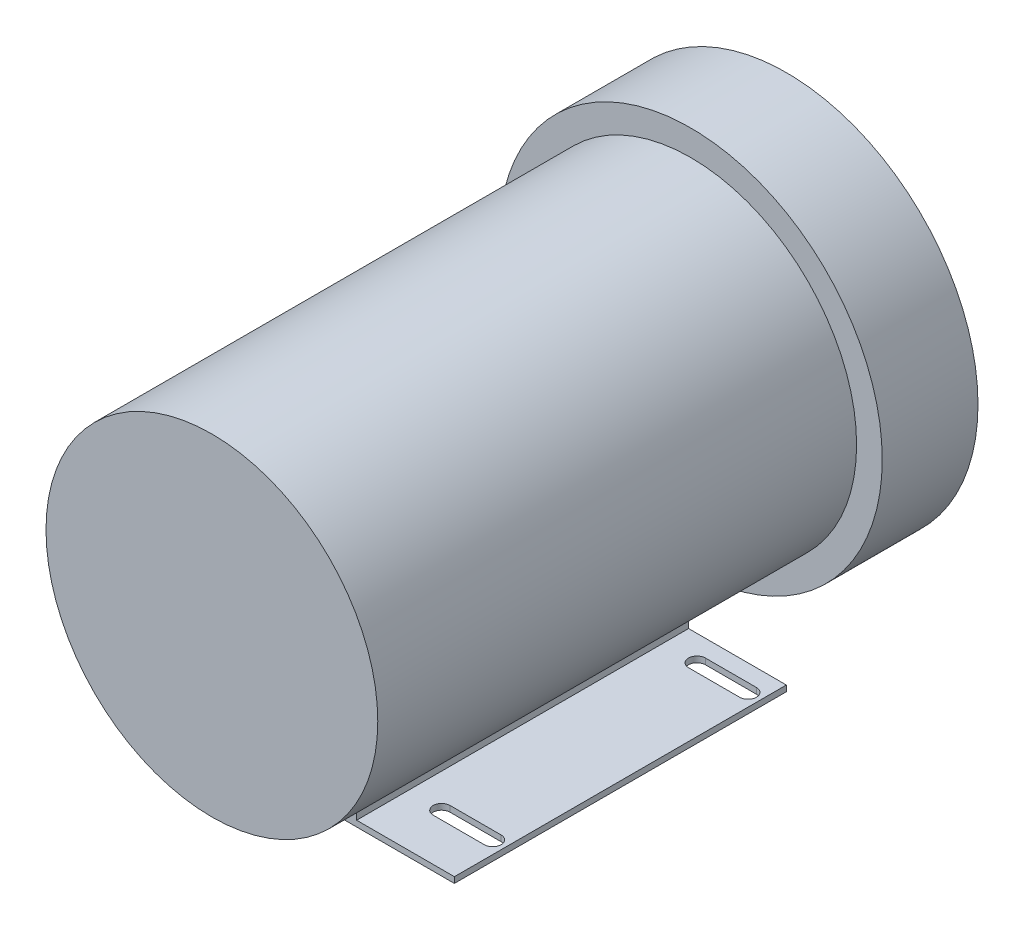
from build123d import *

# Parameters (mm, degrees)
SKETCH1_R           = 82.4992
BOSS_EXTRUDE1_DEPTH = 285.75
SKETCH2_R           = 95.25
BOSS_EXTRUDE2_DEPTH = 47.625
SKETCH3_W           = 164.9984
SKETCH3_H           = 2.921
BOSS_EXTRUDE3_DEPTH = 165.1
CUT_EXTRUDE1_REACH  = 353.525


with BuildPart() as part:
    # Sketch1 → Boss-Extrude1 (new body)
    with BuildSketch(Plane.XY):
        Circle(SKETCH1_R)
    extrude(amount=-BOSS_EXTRUDE1_DEPTH)

    # Sketch2 → Boss-Extrude2 (add)
    with BuildSketch(Plane(origin=(0, 0, -285.75), x_dir=(-1, 0, 0), z_dir=(0, 0, -1))):
        Circle(SKETCH2_R)
    extrude(amount=-BOSS_EXTRUDE2_DEPTH)

    # Sketch3 → Boss-Extrude3 (add)
    with BuildSketch(Plane.XY.offset(-38.1)):
        with BuildLine():
            Line((-33.873610408, -85.979), (33.873610408, -85.979))
            Line((33.873610408, -85.979), (33.873610408, -75.22430803))
            ThreePointArc((33.873610408, -75.22430803), (0, -82.4992), (-33.873610408, -75.22430803))
            Line((-33.873610408, -75.22430803), (-33.873610408, -85.979))
        make_face()
        with Locations((0, -87.4395)):
            Rectangle(SKETCH3_W, SKETCH3_H)
    extrude(amount=-BOSS_EXTRUDE3_DEPTH)

    # Sketch4 → Cut-Extrude1 (cut, up to next)
    with BuildSketch(Plane(origin=(0, -85.979, 0), x_dir=(1, 0, 0), z_dir=(0, 1, 0)), mode=Mode.PRIVATE) as cut_extrude1_sk1:
        with BuildLine():
            Line((-76.1492, 67.691), (-50.7492, 67.691))
            ThreePointArc((-50.7492, 67.691), (-46.5582, 63.5), (-50.7492, 59.309))
            Line((-50.7492, 59.309), (-76.1492, 59.309))
            ThreePointArc((-76.1492, 59.309), (-80.3402, 63.5), (-76.1492, 67.691))
        make_face()
    cut_extrude1_tool1 = extrude(cut_extrude1_sk1.sketch, amount=-CUT_EXTRUDE1_REACH, mode=Mode.PRIVATE) & part.part
    # Sketch4 → Cut-Extrude1 (cut, up to next)
    with BuildSketch(Plane(origin=(0, -85.979, 0), x_dir=(1, 0, 0), z_dir=(0, 1, 0)), mode=Mode.PRIVATE) as cut_extrude1_sk2:
        with BuildLine():
            Line((-50.7492, 186.309), (-76.1492, 186.309))
            ThreePointArc((-76.1492, 186.309), (-80.3402, 190.5), (-76.1492, 194.691))
            Line((-76.1492, 194.691), (-50.7492, 194.691))
            ThreePointArc((-50.7492, 194.691), (-46.5582, 190.5), (-50.7492, 186.309))
        make_face()
    cut_extrude1_tool2 = extrude(cut_extrude1_sk2.sketch, amount=-CUT_EXTRUDE1_REACH, mode=Mode.PRIVATE) & part.part
    cut_extrude1_1 = cut_extrude1_tool1.solids().sort_by_distance((-63.4492, -85.979, -63.5))[0]
    add(cut_extrude1_1, mode=Mode.SUBTRACT)
    cut_extrude1_2 = cut_extrude1_tool2.solids().sort_by_distance((-63.4492, -85.979, -190.5))[0]
    add(cut_extrude1_2, mode=Mode.SUBTRACT)
    cut_extrude1 = cut_extrude1_1 + cut_extrude1_2  # Cut-Extrude1 as one shape, for the pattern or mirror that repeats it

    # Mirror1: Cut-Extrude1 across plane
    add(cut_extrude1.mirror(Plane(origin=(0, 0, 0), x_dir=(0, 0, 1), z_dir=(1, 0, 0))), mode=Mode.SUBTRACT)


solid = part.part
